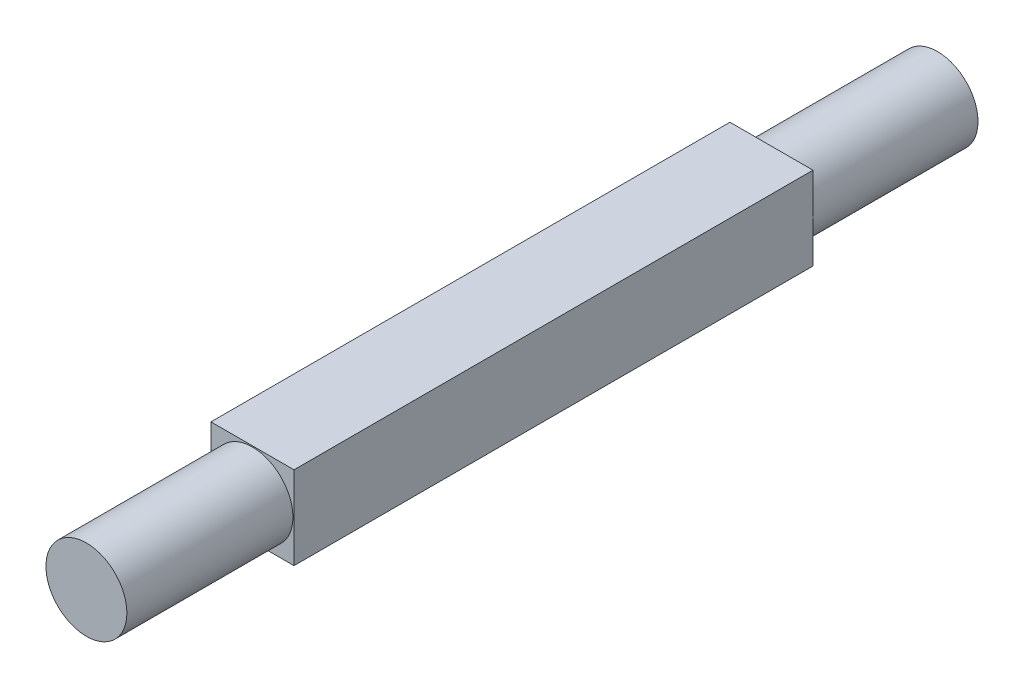
from build123d import *

# Parameters (mm, degrees)
SKETCH1_W           = 4
SKETCH1_H           = 4
BOSS_EXTRUDE1_DEPTH = 12.5
SKETCH2_R           = 1.95
BOSS_EXTRUDE2_DEPTH = 8


with BuildPart() as part:
    # Sketch1 → Boss-Extrude1 (new, symmetric)
    with BuildSketch(Plane.XY):
        Rectangle(SKETCH1_W, SKETCH1_H)
    extrude(amount=BOSS_EXTRUDE1_DEPTH, both=True)

    # Sketch2 → Boss-Extrude2 (add)
    with BuildSketch(Plane.XY.offset(12.5)):
        Circle(SKETCH2_R)
    boss_extrude2 = extrude(amount=BOSS_EXTRUDE2_DEPTH)

    # Mirror2: Boss-Extrude2 across plane
    add(boss_extrude2.mirror(Plane.XY))


solid = part.part
